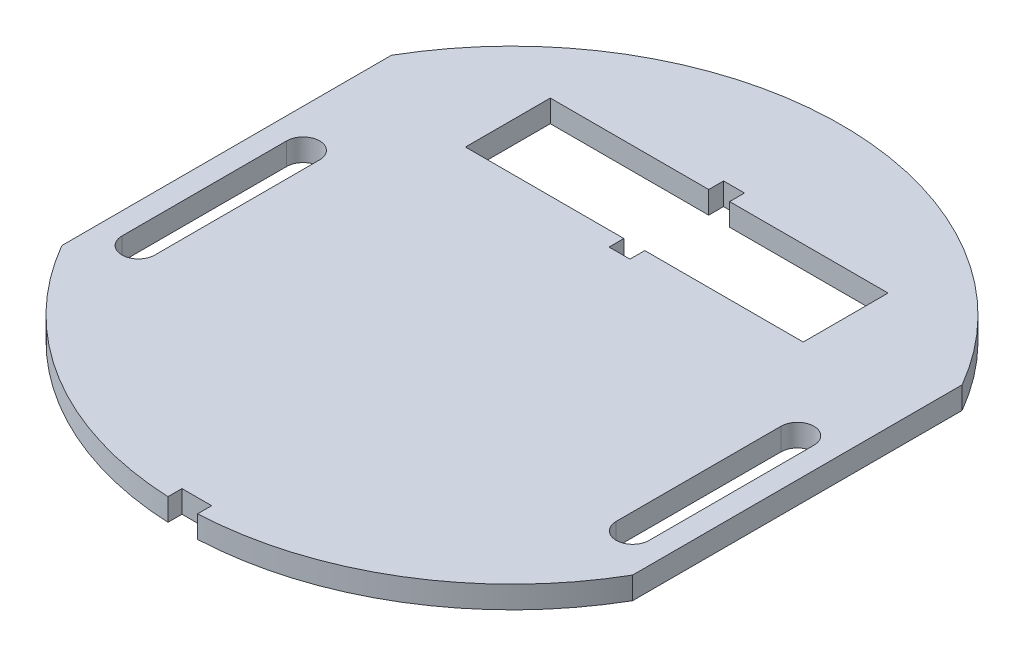
from build123d import *

# Parameters (mm, degrees)
BASE_DEPTH                 = 2.7
WHEEL_HOLE_REACH           = 54.984
BATTERY_HOLE_REACH         = 54.984
IR_SENSOR_DIVOT_DEPTH      = 53.983865469
IR_SENSOR_DIVOT_DEPTH_BACK = 53.983865469


with BuildPart() as part:
    # Sketch1 → Base (new body)
    with BuildSketch(Plane(origin=(0, 0, 0), x_dir=(1, 0, 0), z_dir=(0, 1, 0))):
        with BuildLine():
            Line((34.641016151, 20), (34.641016151, -20))
            ThreePointArc((34.641016151, -20), (0, -40), (-34.641016151, -20))
            Line((-34.641016151, -20), (-34.641016151, 20))
            ThreePointArc((-34.641016151, 20), (0, 40), (34.641016151, 20))
        make_face()
    extrude(amount=BASE_DEPTH)

    # Sketch2 → Wheel Hole (cut, up to next)
    with BuildSketch(Plane(origin=(0, 2.7, 0), x_dir=(-1, 0, 0), z_dir=(0, 1, 0)), mode=Mode.PRIVATE) as wheel_hole_sk1:
        with BuildLine():
            Line((28, -4.65), (28, 15.35))
            ThreePointArc((28, 15.35), (30, 17.35), (32, 15.35))
            Line((32, 15.35), (32, -4.65))
            ThreePointArc((32, -4.65), (30, -6.65), (28, -4.65))
        make_face()
    wheel_hole_tool1 = extrude(wheel_hole_sk1.sketch, amount=-WHEEL_HOLE_REACH, mode=Mode.PRIVATE) & part.part
    wheel_hole = wheel_hole_tool1.solids().sort_by_distance((-30, 2.7, 5.35))[0]
    add(wheel_hole, mode=Mode.SUBTRACT)

    # Sketch6 → Battery Hole (cut, up to next)
    with BuildSketch(Plane(origin=(0, 2.7, 0), x_dir=(-1, 0, 0), z_dir=(0, 1, 0)), mode=Mode.PRIVATE) as battery_hole_sk1:
        Polygon((1.27, -14.85), (1.27, -13.05), (-1.27, -13.05), (-1.27, -14.85), (-20.5, -14.85), (-20.5, -25.15), (-1.27, -25.15), (-1.27, -26.95), (1.27, -26.95), (1.27, -25.15), (20.5, -25.15), (20.5, -14.85), align=None)
    battery_hole_tool1 = extrude(battery_hole_sk1.sketch, amount=-BATTERY_HOLE_REACH, mode=Mode.PRIVATE) & part.part
    add(battery_hole_tool1.solids().sort_by_distance((0, 2.7, -20))[0], mode=Mode.SUBTRACT)

    # Mirror 2: Wheel Hole across plane
    add(wheel_hole.mirror(Plane(origin=(0, 0, 0), x_dir=(0, 0, 1), z_dir=(1, 0, 0))), mode=Mode.SUBTRACT)

    # Sketch5 → IR Sensor Divot (cut, two sides: drawn at the far end of the back side and taken through both)
    with BuildSketch(Plane(origin=(0, 2.7, 0), x_dir=(-1, 0, 0), z_dir=(0, 1, 0)).offset(-IR_SENSOR_DIVOT_DEPTH_BACK)):
        Polygon((-1.8, 225.703224926), (-1.8, 39.959479476), (-1.8, 38.259479476), (1.8, 38.259479476), (1.8, 39.959479476), (1.8, 225.703224926), (1.8, 597.190715827), (-1.8, 597.190715827), align=None)
    extrude(amount=IR_SENSOR_DIVOT_DEPTH + IR_SENSOR_DIVOT_DEPTH_BACK, mode=Mode.SUBTRACT)


solid = part.part
